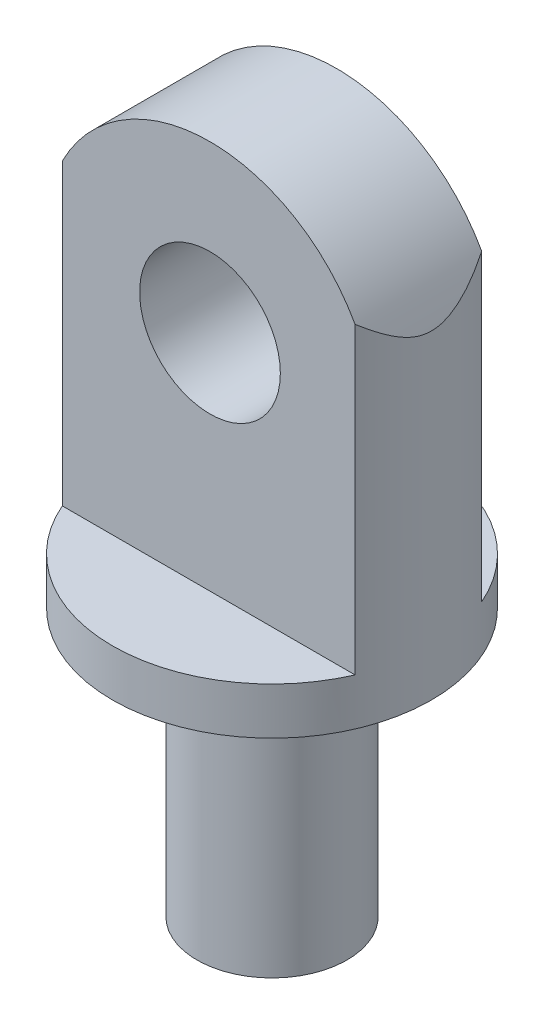
from build123d import *
from build123d.topology import SkipClean

# Parameters (mm, degrees)
SKETCH_1_R          = 3.4
EXTRUDE_3_DEPTH     = 1
EXTRUDE_4_DEPTH     = 8.3
CUT_EXTRUDE_3_DEPTH = 11.982372239
SKETCH_7_R          = 1.5
CUT_EXTRUDE_4_DEPTH = 11.982372355
SKETCH_8_R          = 1.6
EXTRUDE_5_DEPTH     = 5.7


with BuildPart() as part:
    # 草图1 → 凸台-拉伸3 (new body)
    with BuildSketch(Plane(origin=(0, 0, 0), x_dir=(1, 0, 0), z_dir=(0, 1, 0))):
        with Locations(Location((0, 0, 0), (0, 0, 270))):
            Circle(SKETCH_1_R)
    extrude(amount=EXTRUDE_3_DEPTH)

    # 草图5 → 凸台-拉伸4 (add)
    with SkipClean():  # the faces are left unmerged after this step: merging them gives an invalid solid
        with BuildSketch(Plane(origin=(0, 1, 0), x_dir=(1, 0, 0), z_dir=(0, 1, 0))):
            with BuildLine():
                Line((-3.120496755, 1.35), (3.120496755, 1.35))
                ThreePointArc((3.120496755, 1.35), (3.4, 0), (3.120496755, -1.35))
                Line((3.120496755, -1.35), (-3.120496755, -1.35))
                ThreePointArc((-3.120496755, -1.35), (-3.4, 0), (-3.120496755, 1.35))
            make_face()
        extrude(amount=EXTRUDE_4_DEPTH)

    # 草图6 → 切除-拉伸3 (cut, through all)
    with SkipClean():  # the faces are left unmerged after this step: merging them gives an invalid solid
        with BuildSketch(Plane.XY.offset(1.35)):
            with BuildLine():
                Line((-3.4, 6.612575767), (-3.4, 9.766288837))
                Line((-3.4, 9.766288837), (3.4, 9.766288837))
                Line((3.4, 9.766288837), (3.4, 6.81399223))
                ThreePointArc((3.4, 6.81399223), (-0.076572867, 9.298452515), (-3.4, 6.612575767))
            make_face()
        extrude(amount=-CUT_EXTRUDE_3_DEPTH, mode=Mode.SUBTRACT)

    # 草图7 → 切除-拉伸4 (cut, through all)
    with SkipClean():  # the faces are left unmerged after this step: merging them gives an invalid solid
        with BuildSketch(Plane.XY.offset(1.35)):
            with Locations((0.027939034, 5.770037221)):
                Circle(SKETCH_7_R)
        extrude(amount=-CUT_EXTRUDE_4_DEPTH, mode=Mode.SUBTRACT)

    # 草图8 → 凸台-拉伸5 (add)
    with SkipClean():  # the faces are left unmerged after this step: merging them gives an invalid solid
        with BuildSketch(Plane.XZ):
            with Locations(Location((0, 0, 0), (0, 0, 270))):
                Circle(SKETCH_8_R)
        extrude(amount=EXTRUDE_5_DEPTH)


solid = part.part
